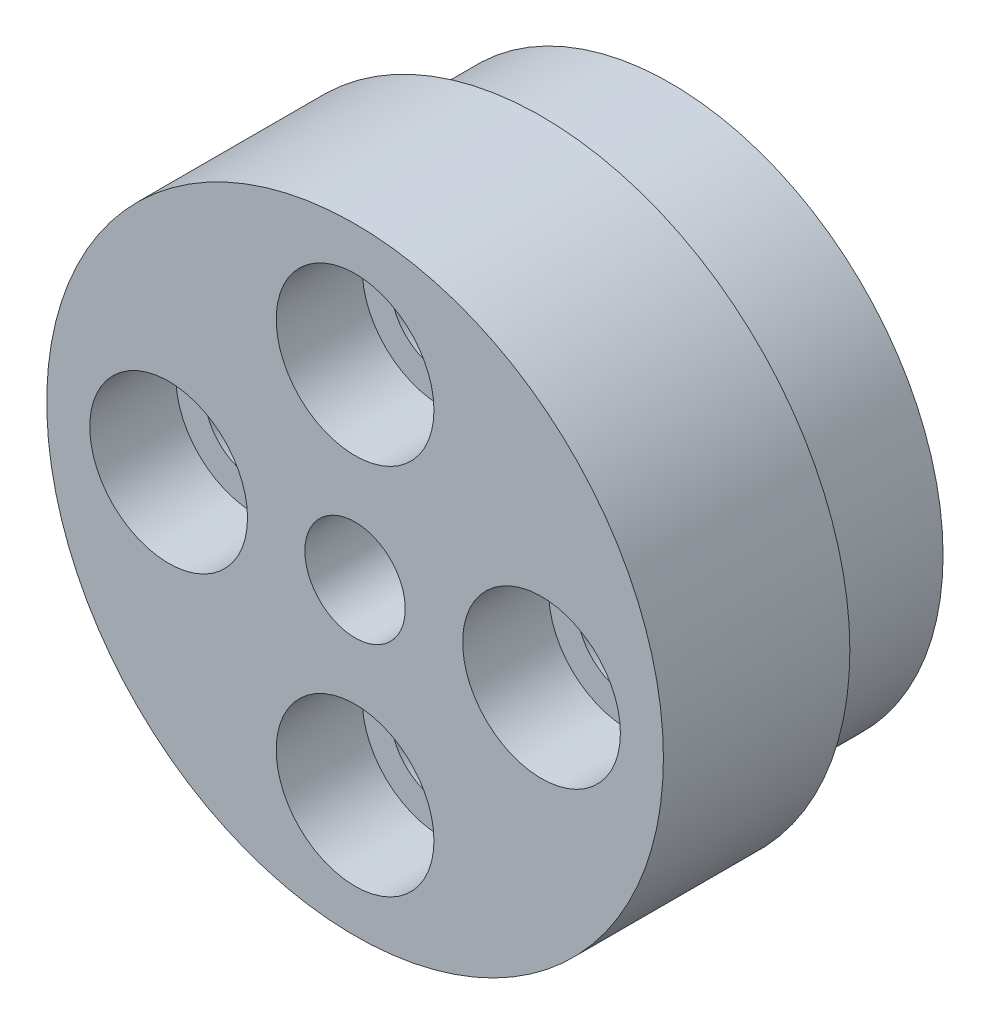
from build123d import *

# Parameters (mm, degrees)
SKETCH1_R           = 9.5
BOSS_EXTRUDE1_DEPTH = 11
SKETCH1_3_R         = 10.75
SKETCH1_3_R_2       = 9.5
BOSS_EXTRUDE2_DEPTH = 6.5
SKETCH3_R           = 1.75
CUT_EXTRUDE2_DEPTH  = 19.764994005
SKETCH4_R           = 1.75
CUT_EXTRUDE4_DEPTH  = 19.764994005
CUT_EXTRUDE5_START  = -8
SKETCH3_4_R         = 2.75
SKETCH3_4_R_2       = 1.75
CUT_EXTRUDE5_DEPTH  = 3


with BuildPart() as part:
    # Sketch1 → Boss-Extrude1 (new body)
    with BuildSketch(Plane.XY):
        Circle(SKETCH1_R)
    extrude(amount=-BOSS_EXTRUDE1_DEPTH)

    # Sketch1<3> → Boss-Extrude2 (add)
    with BuildSketch(Plane.XY):
        Circle(SKETCH1_3_R)
        Circle(SKETCH1_3_R_2, mode=Mode.SUBTRACT)
    extrude(amount=-BOSS_EXTRUDE2_DEPTH)

    # Sketch3 → Cut-Extrude2 (cut, through all)
    with BuildSketch(Plane(origin=(0, 0, -11), x_dir=(-1, 0, 0), z_dir=(0, 0, -1))):
        with Locations((0, 6.5)):
            Circle(SKETCH3_R)
        with Locations((-6.5, 0)):
            Circle(SKETCH3_R)
        with Locations((6.5, 0)):
            Circle(SKETCH3_R)
        with Locations((0, -6.5)):
            Circle(SKETCH3_R)
    extrude(amount=-CUT_EXTRUDE2_DEPTH, mode=Mode.SUBTRACT)

    # Sketch4 → Cut-Extrude4 (cut, through all)
    with BuildSketch(Plane(origin=(0, 0, -11), x_dir=(-1, 0, 0), z_dir=(0, 0, -1))):
        Circle(SKETCH4_R)
    extrude(amount=-CUT_EXTRUDE4_DEPTH, mode=Mode.SUBTRACT)

    # Sketch3<4> → Cut-Extrude5 (cut)
    # profile 1 of 4: a face of its own
    with BuildSketch(Plane(origin=(0, 0, -11), x_dir=(-1, 0, 0), z_dir=(0, 0, -1)).offset(CUT_EXTRUDE5_START)):
        with Locations(Location((-6.5, 0, 0), (0, 0, 180))):
            Circle(SKETCH3_4_R)
        with Locations((-6.5, 0)):
            Circle(SKETCH3_4_R_2, mode=Mode.SUBTRACT)
    # profile 2 of 4: a face of its own
    with BuildSketch(Plane(origin=(0, 0, -11), x_dir=(-1, 0, 0), z_dir=(0, 0, -1)).offset(CUT_EXTRUDE5_START)):
        with Locations(Location((0, 6.5, 0), (0, 0, 180))):
            Circle(SKETCH3_4_R)
        with Locations((0, 6.5)):
            Circle(SKETCH3_4_R_2, mode=Mode.SUBTRACT)
    # profile 3 of 4: a face of its own
    with BuildSketch(Plane(origin=(0, 0, -11), x_dir=(-1, 0, 0), z_dir=(0, 0, -1)).offset(CUT_EXTRUDE5_START)):
        with Locations(Location((6.5, 0, 0), (0, 0, 180))):
            Circle(SKETCH3_4_R)
        with Locations((6.5, 0)):
            Circle(SKETCH3_4_R_2, mode=Mode.SUBTRACT)
    # profile 4 of 4: a face of its own
    with BuildSketch(Plane(origin=(0, 0, -11), x_dir=(-1, 0, 0), z_dir=(0, 0, -1)).offset(CUT_EXTRUDE5_START)):
        with Locations(Location((0, -6.5, 0), (0, 0, 180))):
            Circle(SKETCH3_4_R)
        with Locations((0, -6.5)):
            Circle(SKETCH3_4_R_2, mode=Mode.SUBTRACT)
    extrude(amount=-CUT_EXTRUDE5_DEPTH, mode=Mode.SUBTRACT)


solid = part.part
